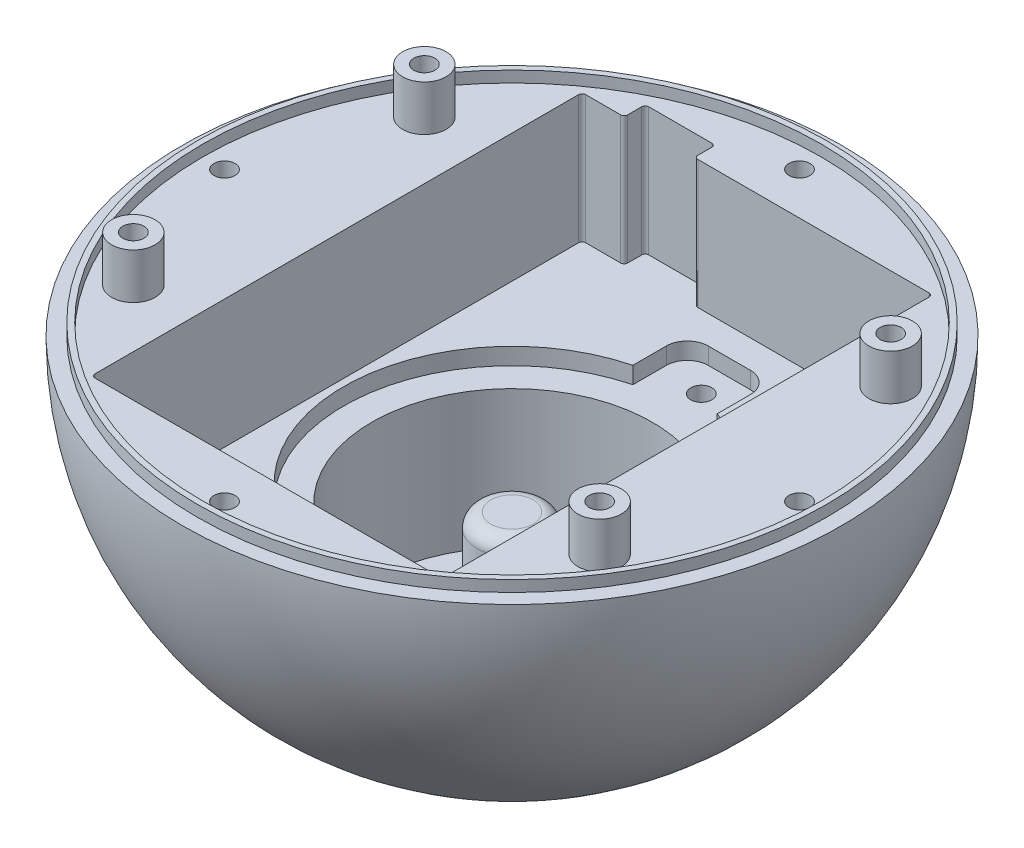
from build123d import *

# Parameters (mm, degrees)
SHPERE_HULL_ANGLE    = 180
SKETCH3_W            = 50
SKETCH3_H            = 70
BATTERY_CAVITY_DEPTH = 18.3
SKETCH7_R            = 1.5
CUT_EXTRUDE4_DEPTH   = 12
PCB_START            = 6.5
SKETCH9_R            = 3.1
SKETCH9_R_2          = 1.5
PCB_STAND_OFFS_DEPTH = 6.5
SKETCH10_W           = 10
SKETCH10_H           = 3
BATTERY_CABLE_DEPTH  = 18.3
SKETCH20_R           = 44.9
SKETCH20_R_2         = 44.1
RAISED_LIP_DEPTH     = 1.6
SKETCH22_R           = 20
BALLAST_AREA_DEPTH   = 22
FILLET2_R            = 0.5
SKETCH23_R           = 1.5
THREADED_HOLES_DEPTH = 10
CIRPATTERN1_COUNT    = 4
SKETCH24_R           = 24
CUT_EXTRUDE5_DEPTH   = 2.4
SKETCH25_R           = 1.5
CUT_EXTRUDE6_DEPTH   = 10
SKETCH26_R           = 5
BOSS_EXTRUDE5_DEPTH  = 18.5
FILLET3_R            = 2


with BuildPart() as part:
    # Sketch19 → Shpere Hull (revolve)
    with BuildSketch(Plane(origin=(0, 22.1, 0), x_dir=(1, 0, 0), z_dir=(0, 1, 0))):
        with BuildLine():
            Line((0, 47), (0, -47))
            ThreePointArc((0, -47), (-47, 0), (0, 47))
        make_face()
    revolve(axis=Axis((0, 22.1, -47), (0, 0, 1)), revolution_arc=SHPERE_HULL_ANGLE)

    # Sketch3 → Battery Cavity (cut)
    with BuildSketch(Plane(origin=(0, 22.1, 0), x_dir=(1, 0, 0), z_dir=(0, 1, 0))):
        Rectangle(SKETCH3_W, SKETCH3_H)
    extrude(amount=-BATTERY_CAVITY_DEPTH, mode=Mode.SUBTRACT)

    # Sketch7 → Cut-Extrude4 (cut)
    with BuildSketch(Plane(origin=(0, 22.1, 0), x_dir=(1, 0, 0), z_dir=(0, 1, 0))):
        with Locations(Location((-33.25, 20.75, 0), (0, 0, 270))):
            Circle(SKETCH7_R)
        with Locations(Location((-33.25, -20.75, 0), (0, 0, 270))):
            Circle(SKETCH7_R)
        with Locations(Location((33.25, 20.75, 0), (0, 0, 270))):
            Circle(SKETCH7_R)
        with Locations(Location((33.25, -20.75, 0), (0, 0, 270))):
            Circle(SKETCH7_R)
    extrude(amount=-CUT_EXTRUDE4_DEPTH, mode=Mode.SUBTRACT)

    # Sketch9 → PCB Stand Offs (add)
    # profile 1 of 4: a face of its own
    with BuildSketch(Plane(origin=(0, 22.1, 0), x_dir=(1, 0, 0), z_dir=(0, 1, 0)).offset(PCB_START)):
        with Locations(Location((-33.25, 20.75, 0), (0, 0, 90))):
            Circle(SKETCH9_R)
        with Locations(Location((-33.25, 20.75, 0), (0, 0, 270))):
            Circle(SKETCH9_R_2, mode=Mode.SUBTRACT)
    # profile 2 of 4: a face of its own
    with BuildSketch(Plane(origin=(0, 22.1, 0), x_dir=(1, 0, 0), z_dir=(0, 1, 0)).offset(PCB_START)):
        with Locations(Location((33.25, 20.75, 0), (0, 0, 90))):
            Circle(SKETCH9_R)
        with Locations(Location((33.25, 20.75, 0), (0, 0, 270))):
            Circle(SKETCH9_R_2, mode=Mode.SUBTRACT)
    # profile 3 of 4: a face of its own
    with BuildSketch(Plane(origin=(0, 22.1, 0), x_dir=(1, 0, 0), z_dir=(0, 1, 0)).offset(PCB_START)):
        with Locations(Location((33.25, -20.75, 0), (0, 0, 90))):
            Circle(SKETCH9_R)
        with Locations(Location((33.25, -20.75, 0), (0, 0, 270))):
            Circle(SKETCH9_R_2, mode=Mode.SUBTRACT)
    # profile 4 of 4: a face of its own
    with BuildSketch(Plane(origin=(0, 22.1, 0), x_dir=(1, 0, 0), z_dir=(0, 1, 0)).offset(PCB_START)):
        with Locations(Location((-33.25, -20.75, 0), (0, 0, 90))):
            Circle(SKETCH9_R)
        with Locations(Location((-33.25, -20.75, 0), (0, 0, 270))):
            Circle(SKETCH9_R_2, mode=Mode.SUBTRACT)
    extrude(amount=-PCB_STAND_OFFS_DEPTH)

    # Sketch10 → Battery Cable (cut)
    with BuildSketch(Plane(origin=(0, 22.1, 0), x_dir=(1, 0, 0), z_dir=(0, 1, 0))):
        with Locations((-14, 36.5)):
            Rectangle(SKETCH10_W, SKETCH10_H)
    extrude(amount=-BATTERY_CABLE_DEPTH, mode=Mode.SUBTRACT)

    # Sketch20 → Raised Lip (add)
    with BuildSketch(Plane(origin=(0, 22.1, 0), x_dir=(1, 0, 0), z_dir=(0, 1, 0))):
        Circle(SKETCH20_R)
        with Locations(Location((0, 0, 0), (0, 0, 180))):
            Circle(SKETCH20_R_2, mode=Mode.SUBTRACT)
    extrude(amount=RAISED_LIP_DEPTH)

    # Sketch22 → Ballast Area (cut)
    with BuildSketch(Plane(origin=(0, 3.8, 0), x_dir=(1, 0, 0), z_dir=(0, 1, 0))):
        with Locations(Location((0, 0, 0), (0, 0, 270))):
            Circle(SKETCH22_R)
    extrude(amount=-BALLAST_AREA_DEPTH, mode=Mode.SUBTRACT)

    # Fillet2
    fillet2_edges = [part.edges().sort_by_distance(p)[0] for p in [
        (-25, 12.95, 35),
        (-25, 12.95, -35),
        (25, 12.95, -35),
        (25, 12.95, 35),
        (-19, 12.95, -35),
        (-19, 12.95, -38),
        (-9, 12.95, -38),
        (-9, 12.95, -35),
    ]]
    fillet(fillet2_edges, radius=FILLET2_R)

    # Sketch23 → Threaded Holes (cut)
    with BuildSketch(Plane(origin=(0, 22.1, 0), x_dir=(1, 0, 0), z_dir=(0, 1, 0))):
        with Locations(Location((0, 41, 0), (0, 0, 180))):
            Circle(SKETCH23_R)
        with Locations(Location((0, -41, 0), (0, 0, 180))):
            Circle(SKETCH23_R)
    threaded_holes = extrude(amount=-THREADED_HOLES_DEPTH, mode=Mode.SUBTRACT)

    # CirPattern1: Threaded Holes ×4 about axis
    cirpattern1_axis = Axis((0, 0, 0), (0, 1, 0))
    for i in range(1, CIRPATTERN1_COUNT):
        add(threaded_holes.rotate(cirpattern1_axis, i * 360 / CIRPATTERN1_COUNT), mode=Mode.SUBTRACT)

    # Sketch24 → Cut-Extrude5 (cut)
    with BuildSketch(Plane(origin=(0, 3.8, 0), x_dir=(1, 0, 0), z_dir=(0, 1, 0))):
        Circle(SKETCH24_R)
        with BuildLine():
            Line((3, -31), (-3, -31))
            ThreePointArc((-3, -31), (-5.121320344, -30.121320344), (-6, -28))
            Line((-6, -28), (-6, 28))
            ThreePointArc((-6, 28), (-5.121320344, 30.121320344), (-3, 31))
            Line((-3, 31), (3, 31))
            ThreePointArc((3, 31), (5.121320344, 30.121320344), (6, 28))
            Line((6, 28), (6, -28))
            ThreePointArc((6, -28), (5.121320344, -30.121320344), (3, -31))
        make_face()
    extrude(amount=-CUT_EXTRUDE5_DEPTH, mode=Mode.SUBTRACT)

    # Sketch25 → Cut-Extrude6 (cut)
    with BuildSketch(Plane(origin=(0, 1.4, 0), x_dir=(1, 0, 0), z_dir=(0, 1, 0))):
        with Locations(Location((0, 27, 0), (0, 0, 270))):
            Circle(SKETCH25_R)
        with Locations(Location((0, -27, 0), (0, 0, 270))):
            Circle(SKETCH25_R)
    extrude(amount=-CUT_EXTRUDE6_DEPTH, mode=Mode.SUBTRACT)

    # Sketch26 → Boss-Extrude5 (add)
    with BuildSketch(Plane(origin=(0, -18.2, 0), x_dir=(1, 0, 0), z_dir=(0, 1, 0))):
        with Locations(Location((0, 0, 0), (0, 0, 270))):
            Circle(SKETCH26_R)
    extrude(amount=BOSS_EXTRUDE5_DEPTH)

    # Fillet3
    fillet3_edges = [part.edges().sort_by_distance(p)[0] for p in [
        (0, 0.3, -5),
    ]]
    fillet(fillet3_edges, radius=FILLET3_R)


solid = part.part
